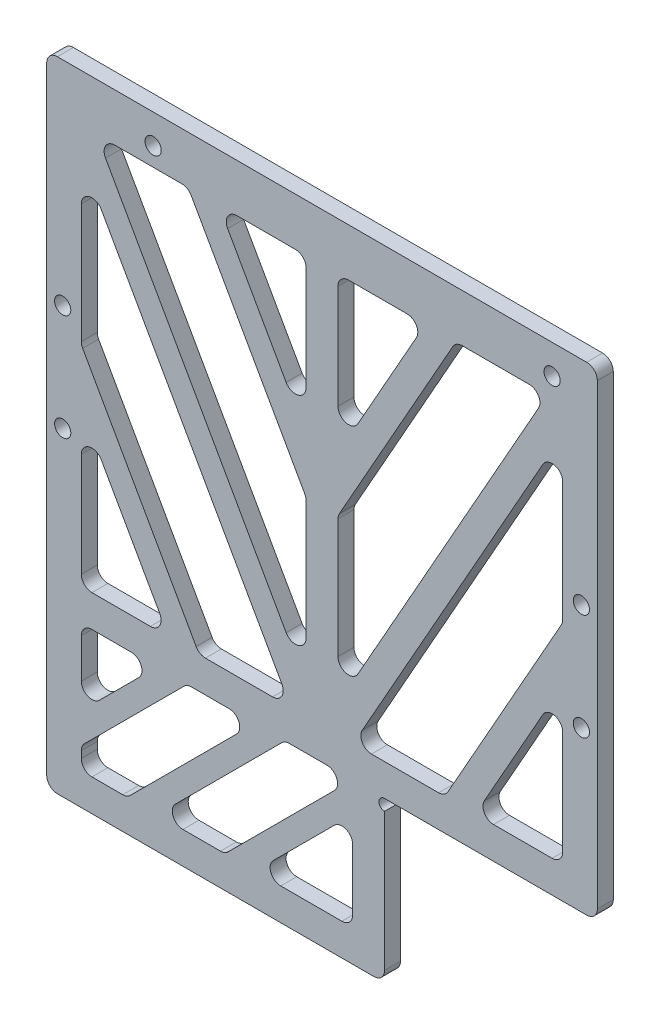
from build123d import *

# Parameters (mm, degrees)
SKETCH_1_W          = 103.5
SKETCH_1_H          = 90
EXTRUDE_1_DEPTH     = 1.5
SKETCH_2_W          = 63.5
SKETCH_2_H          = 30
EXTRUDE_2_DEPTH     = 3
SKETCH_3_R          = 1.05
CUT_EXTRUDE_1_DEPTH = 3
SKETCH_4_R          = 1.525
CUT_EXTRUDE_2_DEPTH = 10
SKETCH_5_R          = 1.525
CUT_EXTRUDE_3_DEPTH = 10
FILLET_1_R          = 2
CUT_EXTRUDE_4_DEPTH = 10
CUT_EXTRUDE_5_DEPTH = 10
FILLET_2_R          = 2


with BuildPart() as part:
    # 草图1 → 凸台-拉伸1 (new, symmetric)
    with BuildSketch(Plane.XY):
        Rectangle(SKETCH_1_W, SKETCH_1_H)
    extrude(amount=EXTRUDE_1_DEPTH, both=True)

    # 草图2 → 凸台-拉伸2 (add)
    with BuildSketch(Plane.XY.offset(1.5)):
        with Locations((-20, -60)):
            Rectangle(SKETCH_2_W, SKETCH_2_H)
    extrude(amount=-EXTRUDE_2_DEPTH)

    # 草图3 → 切除-拉伸1 (cut)
    with BuildSketch(Plane(origin=(0, 0, -1.5), x_dir=(-1, 0, 0), z_dir=(0, 0, -1))):
        with Locations((-11.75, -46.05)):
            Circle(SKETCH_3_R)
    extrude(amount=-CUT_EXTRUDE_1_DEPTH, mode=Mode.SUBTRACT)

    # 草图4 → 切除-拉伸2 (cut)
    with BuildSketch(Plane.XY.offset(1.5)):
        with Locations((-31.749999997, 39.499993227)):
            Circle(SKETCH_4_R)
        with Locations((43.25, 39.499993227)):
            Circle(SKETCH_4_R)
    extrude(amount=-CUT_EXTRUDE_2_DEPTH, mode=Mode.SUBTRACT)

    # 草图5 → 切除-拉伸3 (cut)
    with BuildSketch(Plane(origin=(0, 0, -1.5), x_dir=(-1, 0, 0), z_dir=(0, 0, -1))):
        with Locations((48.75, -15)):
            Circle(SKETCH_5_R)
        with Locations((48.75, 5)):
            Circle(SKETCH_5_R)
    cut_extrude_3 = extrude(amount=-CUT_EXTRUDE_3_DEPTH, mode=Mode.SUBTRACT)

    # 镜向1: 切除-拉伸3 across plane
    add(cut_extrude_3.mirror(Plane(origin=(0, 0, 0), x_dir=(0, 0, 1), z_dir=(1, 0, 0))), mode=Mode.SUBTRACT)

    # 圆角1
    fillet_1_edges = [part.edges().sort_by_distance(p)[0] for p in [
        (11.75, -75, 0),
        (-51.75, -75, 0),
        (51.75, -45, 0),
        (-51.75, 45, 0),
        (51.75, 45, 0),
    ]]
    fillet(fillet_1_edges, radius=FILLET_1_R)

    # 草图6 → 切除-拉伸4 (cut)
    with BuildSketch(Plane(origin=(0, 0, -1.5), x_dir=(-1, 0, 0), z_dir=(0, 0, -1))):
        Polygon((-28.82451653, -39), (-45.25, -9.842339669), (-45.25, -39), align=None)
        Polygon((-5.869390726, -39), (-45.25, 30.906400683), (-45.25, 0.344845419), (-23.085735079, -39), align=None)
        Polygon((-25.164264921, 35.999993227), (-42.380609274, 35.999993227), (-3, -33.906407456), (-3, -3.344852192), align=None)
        Polygon((-3, 35.999993227), (-19.42548347, 35.999993227), (-3, 6.842332896), align=None)
        Polygon((3, 6.842332896), (19.42548347, 35.999993227), (3, 35.999993227), align=None)
        Polygon((42.380609274, 35.999993227), (25.164264921, 35.999993227), (3, -3.344852192), (3, -33.906407456), align=None)
        Polygon((45.25, 0.344845419), (45.25, 30.906400683), (5.869390726, -39), (23.085735079, -39), align=None)
        Polygon((45.25, -39), (45.25, -9.842339669), (28.82451653, -39), align=None)
    extrude(amount=-CUT_EXTRUDE_4_DEPTH, mode=Mode.SUBTRACT)

    # 草图7 → 切除-拉伸5 (cut)
    with BuildSketch(Plane(origin=(0, 0, -1.5), x_dir=(-1, 0, 0), z_dir=(0, 0, -1))):
        Polygon((12.593145751, -69), (-5.75, -50.656854249), (-5.75, -69), align=None)
        Polygon((6.977922061, -45), (-5.75, -45), (18.25, -69), (30.977922061, -69), align=None)
        Polygon((25.362698372, -45), (12.634776311, -45), (36.634776311, -69), (45.25, -69), (45.25, -64.887301628), align=None)
        Polygon((45.25, -45), (31.019552622, -45), (45.25, -59.230447378), align=None)
    extrude(amount=-CUT_EXTRUDE_5_DEPTH, mode=Mode.SUBTRACT)

    # 圆角2
    fillet_2_edges = [part.edges().sort_by_distance(p)[0] for p in [
        (-3, 6.842332896, 0),
        (-3, 35.999993227, 0),
        (-19.42548347, 35.999993227, 0),
        (19.42548347, 35.999993227, 0),
        (3, 35.999993227, 0),
        (3, 6.842332896, 0),
        (45.25, 0.344845419, 0),
        (45.25, 30.906400683, 0),
        (5.869390726, -39, 0),
        (23.085735079, -39, 0),
        (25.164264921, 35.999993227, 0),
        (3, -3.344852192, 0),
        (3, -33.906407456, 0),
        (42.380609274, 35.999993227, 0),
        (-45.25, -9.842339669, 0),
        (-45.25, -39, 0),
        (-28.82451653, -39, 0),
        (-3, -33.906407456, 0),
        (-3, -3.344852192, 0),
        (-25.164264921, 35.999993227, 0),
        (-42.380609274, 35.999993227, 0),
        (-45.25, 30.906400683, 0),
        (-45.25, 0.344845419, 0),
        (-23.085735079, -39, 0),
        (-5.869390726, -39, 0),
        (45.25, -9.842339669, 0),
        (28.82451653, -39, 0),
        (45.25, -39, 0),
        (-25.362698372, -45, 0),
        (-45.25, -64.887301628, 0),
        (-45.25, -69, 0),
        (-36.634776311, -69, 0),
        (-12.634776311, -45, 0),
        (-6.977922061, -45, 0),
        (-30.977922061, -69, 0),
        (-18.25, -69, 0),
        (5.75, -45, 0),
        (-31.019552622, -45, 0),
        (-45.25, -45, 0),
        (-45.25, -59.230447378, 0),
        (5.75, -50.656854249, 0),
        (-12.593145751, -69, 0),
        (5.75, -69, 0),
    ]]
    fillet(fillet_2_edges, radius=FILLET_2_R)


solid = part.part
